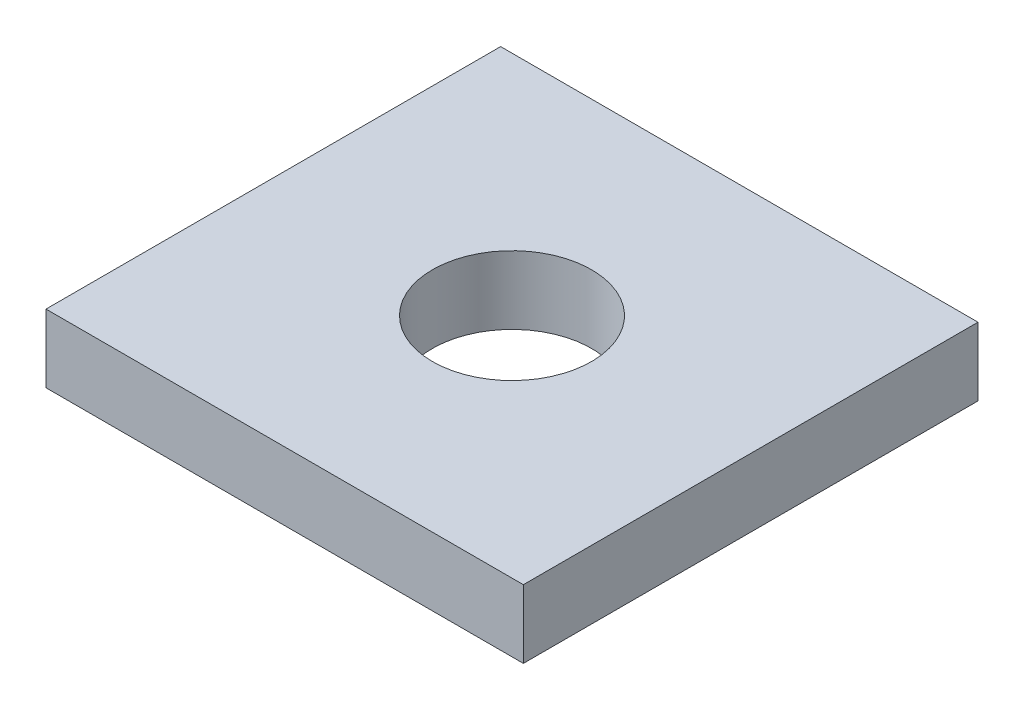
from build123d import *

# Parameters (mm, degrees)
SKETCH1_W           = 42
SKETCH1_H           = 40
BOSS_EXTRUDE1_DEPTH = 6
SKETCH2_R           = 7
CUT_EXTRUDE1_DEPTH  = 10


with BuildPart() as part:
    # Sketch1 → Boss-Extrude1 (new body)
    with BuildSketch(Plane(origin=(0, 0, 0), x_dir=(1, 0, 0), z_dir=(0, 1, 0))):
        Rectangle(SKETCH1_W, SKETCH1_H)
    extrude(amount=BOSS_EXTRUDE1_DEPTH)

    # Sketch2 → Cut-Extrude1 (cut)
    with BuildSketch(Plane(origin=(0, 6, 0), x_dir=(1, 0, 0), z_dir=(0, 1, 0))):
        with Locations(Location((0, 0, 0), (0, 0, 270))):
            Circle(SKETCH2_R)
    extrude(amount=-CUT_EXTRUDE1_DEPTH, mode=Mode.SUBTRACT)


solid = part.part
